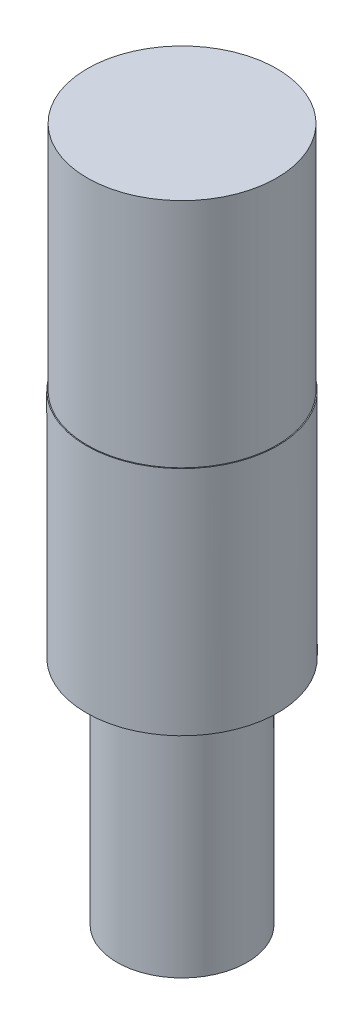
from build123d import *

# Parameters (mm, degrees)
SKETCH1_R           = 5.55625
BOSS_EXTRUDE1_DEPTH = 38.1
SKETCH2_R           = 6.632995555
SKETCH2_R_2         = 5.2
CUT_EXTRUDE1_DEPTH  = 12.7
SKETCH3_R           = 7.248285052
SKETCH3_R_2         = 5.25
CUT_EXTRUDE2_DEPTH  = 12.7
SKETCH4_R           = 6.521090142
SKETCH4_R_2         = 3.5687
CUT_EXTRUDE3_DEPTH  = 12.7


with BuildPart() as part:
    # Sketch1 → Boss-Extrude1 (new body)
    with BuildSketch(Plane(origin=(0, 0, 0), x_dir=(1, 0, 0), z_dir=(0, 1, 0))):
        with Locations(Location((0, 0, 0), (0, 0, 90))):
            Circle(SKETCH1_R)
    extrude(amount=BOSS_EXTRUDE1_DEPTH)

    # Sketch2 → Cut-Extrude1 (cut)
    with BuildSketch(Plane(origin=(0, 38.1, 0), x_dir=(1, 0, 0), z_dir=(0, 1, 0))):
        Circle(SKETCH2_R)
        with Locations(Location((0, 0, 0), (0, 0, 270))):
            Circle(SKETCH2_R_2, mode=Mode.SUBTRACT)
    extrude(amount=-CUT_EXTRUDE1_DEPTH, mode=Mode.SUBTRACT)

    # Sketch3 → Cut-Extrude2 (cut)
    with BuildSketch(Plane(origin=(0, 25.4, 0), x_dir=(1, 0, 0), z_dir=(0, 1, 0))):
        Circle(SKETCH3_R)
        with Locations(Location((0, 0, 0), (0, 0, 270))):
            Circle(SKETCH3_R_2, mode=Mode.SUBTRACT)
    extrude(amount=-CUT_EXTRUDE2_DEPTH, mode=Mode.SUBTRACT)

    # Sketch4 → Cut-Extrude3 (cut)
    with BuildSketch(Plane.XZ):
        Circle(SKETCH4_R)
        with Locations(Location((0, 0, 0), (0, 0, 270))):
            Circle(SKETCH4_R_2, mode=Mode.SUBTRACT)
    extrude(amount=-CUT_EXTRUDE3_DEPTH, mode=Mode.SUBTRACT)


solid = part.part
